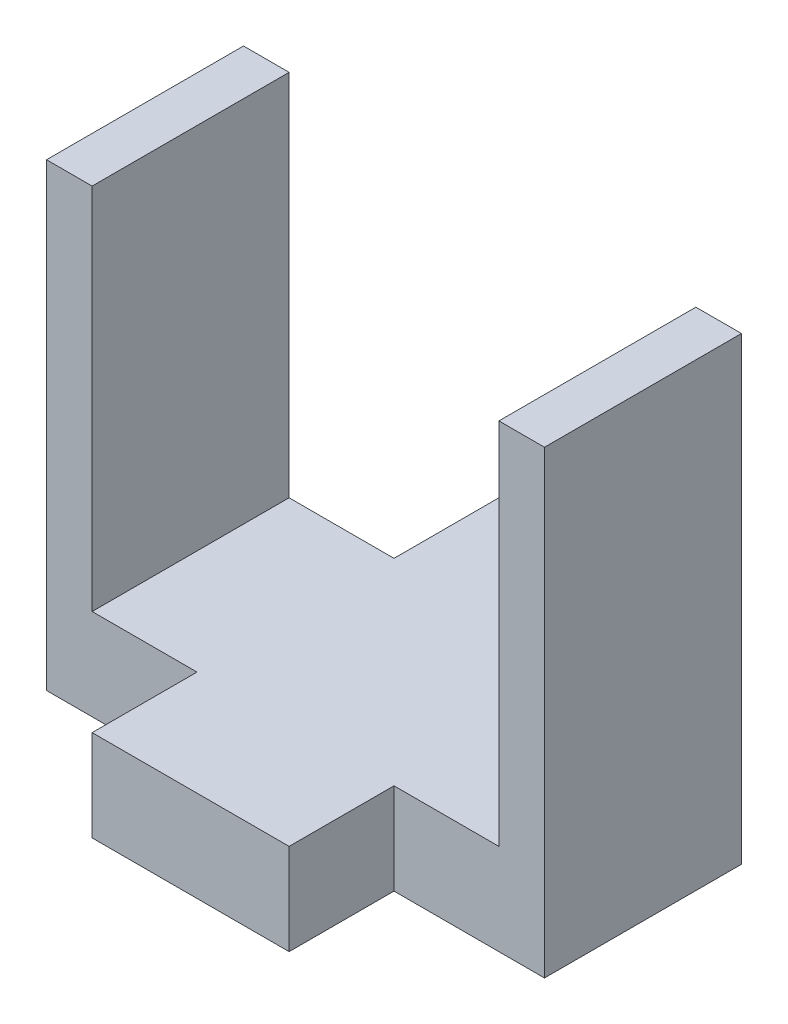
from build123d import *

# Parameters (mm, degrees)
RESSALTO_EXTRUS_O1_DEPTH = 10
ESBO_O2_W                = 5
ESBO_O2_H                = 21.6
RESSALTO_EXTRUS_O2_DEPTH = 50.4


with BuildPart() as part:
    # Esboço1 → Ressalto-extrusão1 (new body)
    with BuildSketch(Plane(origin=(0, 0, 0), x_dir=(1, 0, 0), z_dir=(0, 1, 0))):
        Polygon((-10.8, 22.3), (-10.8, 10.8), (-22.3, 10.8), (-22.3, -10.8), (-10.8, -10.8), (-10.8, -22.3), (10.8, -22.3), (10.8, -10.8), (22.3, -10.8), (22.3, 10.8), (10.8, 10.8), (10.8, 22.3), align=None)
    extrude(amount=RESSALTO_EXTRUS_O1_DEPTH)

    # Esboço2 → Ressalto-extrusão2 (add)
    with BuildSketch(Plane(origin=(0, 0, 0), x_dir=(1, 0, 0), z_dir=(0, 1, 0))):
        with Locations((24.8, 0)):
            Rectangle(ESBO_O2_W, ESBO_O2_H)
        with Locations((-24.8, 0)):
            Rectangle(ESBO_O2_W, ESBO_O2_H)
    extrude(amount=RESSALTO_EXTRUS_O2_DEPTH)


solid = part.part
